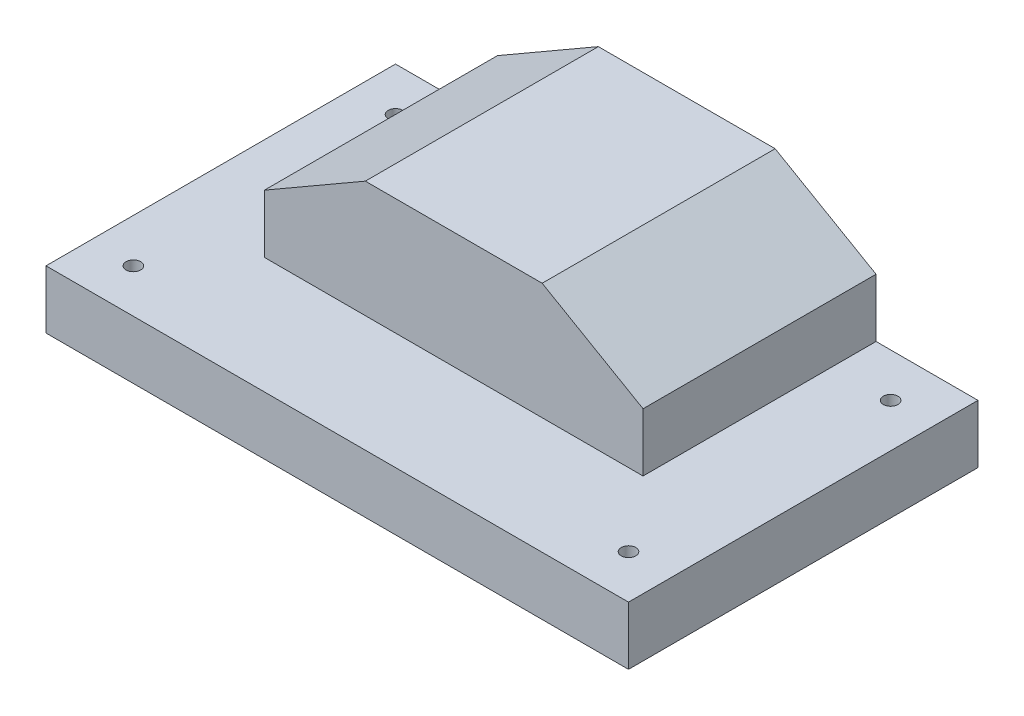
from build123d import *

# Parameters (mm, degrees)
SKETCH1_W                    = 127
SKETCH1_H                    = 12.7
BOSS_EXTRUDE1_DEPTH          = 76.2
BOSS_EXTRUDE3_DEPTH          = 50.8
F_1_8_0_125_DIAMETER_HOLE1_D = 3.175


with BuildPart() as part:
    # Sketch1 → Boss-Extrude1 (new body)
    with BuildSketch(Plane.XY):
        with Locations((0, 6.35)):
            Rectangle(SKETCH1_W, SKETCH1_H)
    extrude(amount=BOSS_EXTRUDE1_DEPTH)

    # Sketch2 → Boss-Extrude3 (add)
    with BuildSketch(Plane(origin=(0, 0, 0), x_dir=(-1, 0, 0), z_dir=(0, 0, -1))):
        Polygon((-41.275, 12.7), (41.275, 12.7), (41.275, 25.4), (19.277954744, 38.1), (-19.277954744, 38.1), (-41.275, 25.4), align=None)
    extrude(amount=-BOSS_EXTRUDE3_DEPTH)

    # 1/8 (0.125) Diameter Hole1 (through all)
    with Locations(Plane(origin=(0, 12.7, 0), x_dir=(1, 0, 0), z_dir=(0, 1, 0))):
        with Locations((53.975, -9.525), (-53.975, -9.525), (-53.975, -66.675), (53.975, -66.675)):
            Hole(F_1_8_0_125_DIAMETER_HOLE1_D / 2)


solid = part.part
